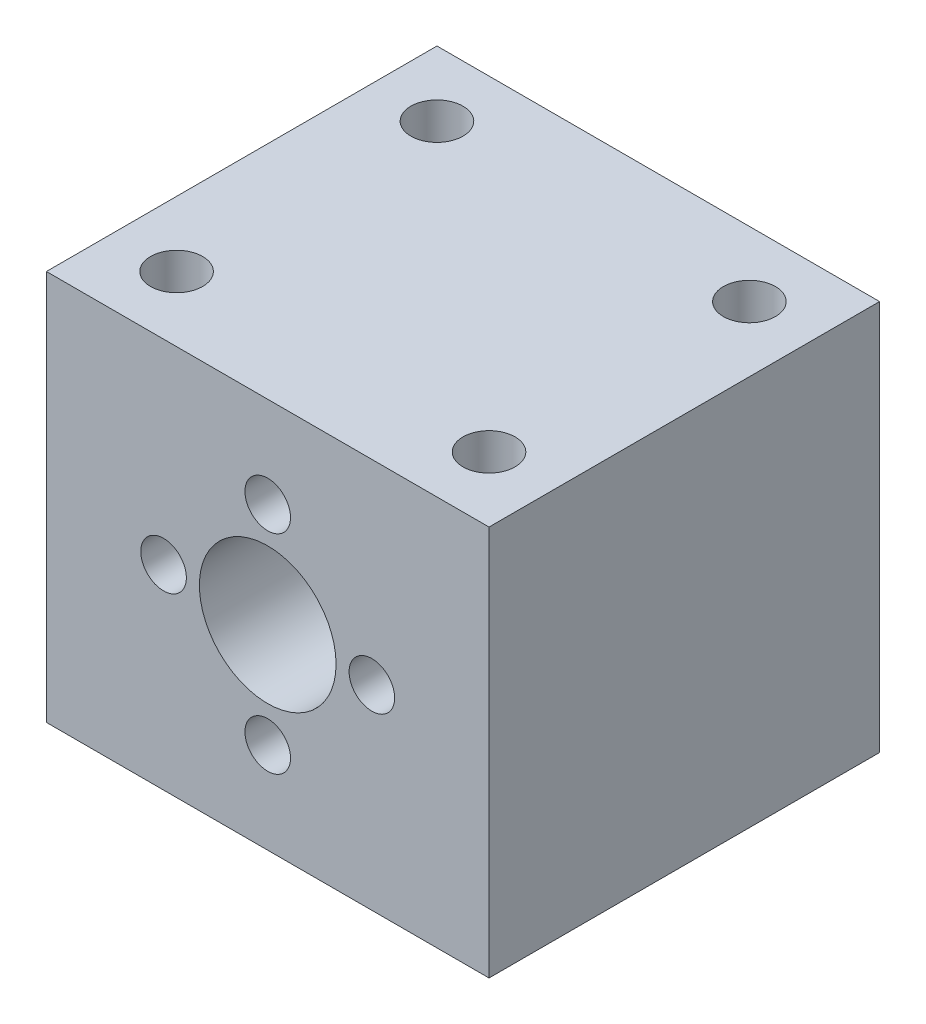
from build123d import *

# Parameters (mm, degrees)
SKETCH_1_W          = 34
SKETCH_1_H          = 30
SKETCH_1_R          = 5.25
EXTRUDE_1_DEPTH     = 30
SKETCH_2_R          = 1.75
CUT_EXTRUDE_1_DEPTH = 10
SKETCH_4_R          = 2
CUT_EXTRUDE_3_DEPTH = 10
SKETCH_5_R          = 1.5
CUT_EXTRUDE_4_DEPTH = 5


with BuildPart() as part:
    # 草图1 → 凸台-拉伸1 (new body)
    with BuildSketch(Plane.XY):
        Rectangle(SKETCH_1_W, SKETCH_1_H)
        Circle(SKETCH_1_R, mode=Mode.SUBTRACT)
    extrude(amount=EXTRUDE_1_DEPTH)

    # 草图2 → 切除-拉伸1 (cut)
    with BuildSketch(Plane.XY.offset(30)):
        with Locations((-8, 0)):
            Circle(SKETCH_2_R)
        with Locations((0, 8)):
            Circle(SKETCH_2_R)
        with Locations((8, 0)):
            Circle(SKETCH_2_R)
        with Locations((0, -8)):
            Circle(SKETCH_2_R)
    extrude(amount=-CUT_EXTRUDE_1_DEPTH, mode=Mode.SUBTRACT)

    # 草图4 → 切除-拉伸3 (cut)
    with BuildSketch(Plane(origin=(0, 15, 0), x_dir=(1, 0, 0), z_dir=(0, 1, 0))):
        with Locations(Location((12, -25, 0), (0, 0, 180))):
            Circle(SKETCH_4_R)
        with Locations(Location((-12, -25, 0), (0, 0, 180))):
            Circle(SKETCH_4_R)
        with Locations(Location((-12, -5, 0), (0, 0, 180))):
            Circle(SKETCH_4_R)
        with Locations(Location((12, -5, 0), (0, 0, 180))):
            Circle(SKETCH_4_R)
    extrude(amount=-CUT_EXTRUDE_3_DEPTH, mode=Mode.SUBTRACT)

    # 草图5 → 切除-拉伸4 (cut)
    with BuildSketch(Plane(origin=(0, -15, 0), x_dir=(-1, 0, 0), z_dir=(0, -1, 0))):
        with Locations(Location((1, -25, 0), (0, 0, 180))):
            Circle(SKETCH_5_R)
        with Locations(Location((6, -25, 0), (0, 0, 180))):
            Circle(SKETCH_5_R)
    extrude(amount=-CUT_EXTRUDE_4_DEPTH, mode=Mode.SUBTRACT)


solid = part.part
